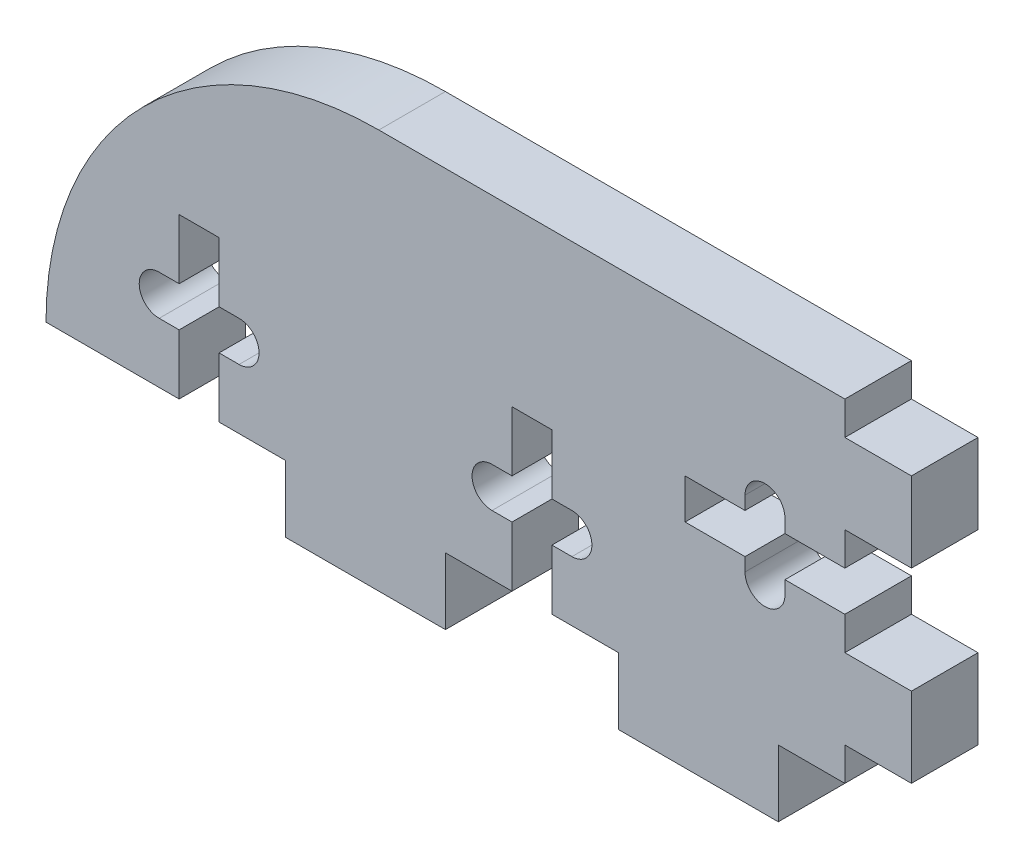
from build123d import *

# Parameters (mm, degrees)
BOSS_EXTRUDE1_DEPTH = 5


with BuildPart() as part:
    # Sketch1 → Boss-Extrude1 (new body)
    with BuildSketch(Plane.XY):
        with BuildLine():
            Line((23.963951988, -5.840885969), (18.963951988, -5.840885969))
            Line((18.963951988, -5.840885969), (18.963951988, -10.840885969))
            Line((18.963951988, -10.840885969), (6.963951988, -10.840885969))
            Line((6.963951988, -10.840885969), (6.963951988, -5.840885969))
            Line((6.963951988, -5.840885969), (1.963951988, -5.840885969))
            Line((1.963951988, -5.840885969), (1.963951988, -1.340885969))
            Line((1.963951988, -1.340885969), (3.463951988, -1.340885969))
            ThreePointArc((3.463951988, -1.340885969), (4.963951988, 0.159114031), (3.463951988, 1.659114031))
            Line((3.463951988, 1.659114031), (1.963951988, 1.659114031))
            Line((1.963951988, 1.659114031), (1.963951988, 6.159114031))
            Line((1.963951988, 6.159114031), (-1.036048012, 6.159114031))
            Line((-1.036048012, 6.159114031), (-1.036048012, 1.659114031))
            Line((-1.036048012, 1.659114031), (-2.536048012, 1.659114031))
            ThreePointArc((-2.536048012, 1.659114031), (-4.036048012, 0.159114031), (-2.536048012, -1.340885969))
            Line((-2.536048012, -1.340885969), (-1.036048012, -1.340885969))
            Line((-1.036048012, -1.340885969), (-1.036048012, -5.840885969))
            Line((-1.036048012, -5.840885969), (-6.036048012, -5.840885969))
            Line((-6.036048012, -5.840885969), (-6.036048012, -10.840885969))
            Line((-6.036048012, -10.840885969), (-18.036048012, -10.840885969))
            Line((-18.036048012, -10.840885969), (-18.036048012, -5.840885969))
            Line((-18.036048012, -5.840885969), (-23.036048012, -5.840885969))
            Line((-23.036048012, -5.840885969), (-23.036048012, -1.340885969))
            Line((-23.036048012, -1.340885969), (-21.536048012, -1.340885969))
            ThreePointArc((-21.536048012, -1.340885969), (-20.036048012, 0.159114031), (-21.536048012, 1.659114031))
            Line((-21.536048012, 1.659114031), (-23.036048012, 1.659114031))
            Line((-23.036048012, 1.659114031), (-23.036048012, 6.159114031))
            Line((-23.036048012, 6.159114031), (-26.036048012, 6.159114031))
            Line((-26.036048012, 6.159114031), (-26.036048012, 1.659114031))
            Line((-26.036048012, 1.659114031), (-27.536048012, 1.659114031))
            ThreePointArc((-27.536048012, 1.659114031), (-29.036048012, 0.159114031), (-27.536048012, -1.340885969))
            Line((-27.536048012, -1.340885969), (-26.036048012, -1.340885969))
            Line((-26.036048012, -1.340885969), (-26.036048012, -5.840885969))
            Line((-26.036048012, -5.840885969), (-36.036048012, -5.840885969))
            ThreePointArc((-36.036048012, -5.840885969), (-28.713717542, 11.836783561), (-11.036048012, 19.159114031))
            Line((-11.036048012, 19.159114031), (23.963951988, 19.159114031))
            Line((23.963951988, 19.159114031), (23.963951988, 16.659114031))
            Line((23.963951988, 16.659114031), (28.963951988, 16.659114031))
            Line((28.963951988, 16.659114031), (28.963951988, 10.659114031))
            Line((28.963951988, 10.659114031), (23.963951988, 10.659114031))
            Line((23.963951988, 10.659114031), (23.963951988, 8.159114031))
            Line((23.963951988, 8.159114031), (19.463951988, 8.159114031))
            Line((19.463951988, 8.159114031), (19.463951988, 9.159114031))
            ThreePointArc((19.463951988, 9.159114031), (17.963951988, 10.659114031), (16.463951988, 9.159114031))
            Line((16.463951988, 9.159114031), (16.463951988, 8.159114031))
            Line((16.463951988, 8.159114031), (11.963951988, 8.159114031))
            Line((11.963951988, 8.159114031), (11.963951988, 5.159114031))
            Line((11.963951988, 5.159114031), (16.463951988, 5.159114031))
            Line((16.463951988, 5.159114031), (16.463951988, 4.159114031))
            ThreePointArc((16.463951988, 4.159114031), (17.963951988, 2.659114031), (19.463951988, 4.159114031))
            Line((19.463951988, 4.159114031), (19.463951988, 5.159114031))
            Line((19.463951988, 5.159114031), (23.963951988, 5.159114031))
            Line((23.963951988, 5.159114031), (23.963951988, 2.659114031))
            Line((23.963951988, 2.659114031), (28.963951988, 2.659114031))
            Line((28.963951988, 2.659114031), (28.963951988, -3.340885969))
            Line((28.963951988, -3.340885969), (23.963951988, -3.340885969))
            Line((23.963951988, -3.340885969), (23.963951988, -5.840885969))
        make_face()
    extrude(amount=BOSS_EXTRUDE1_DEPTH)


solid = part.part
